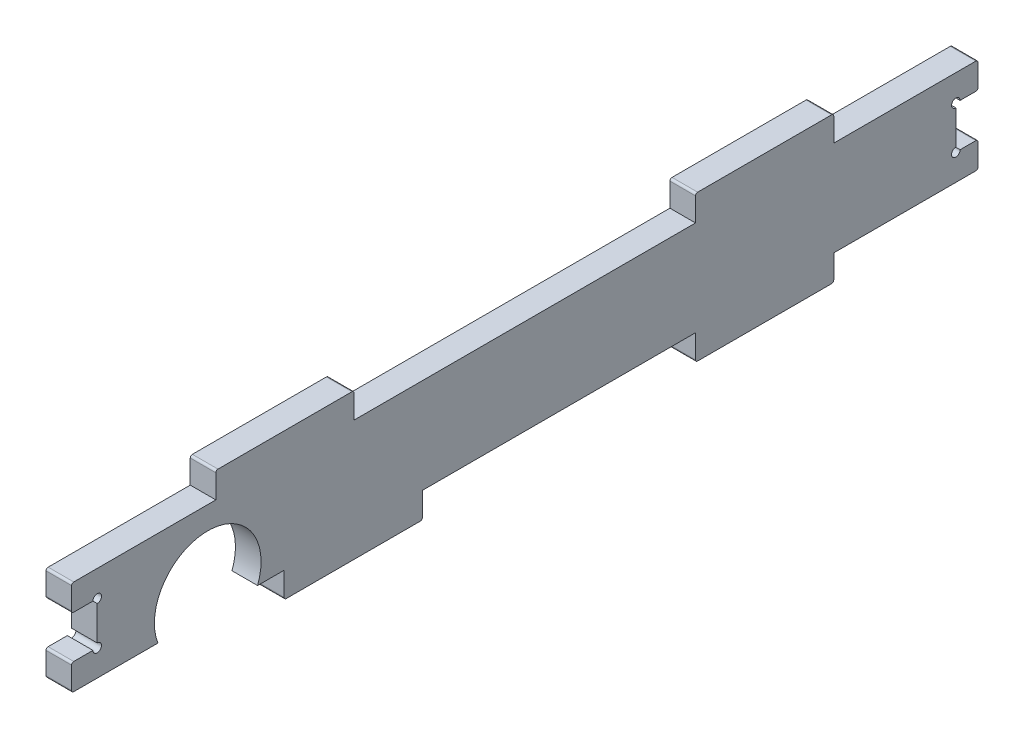
from build123d import *

# Parameters (mm, degrees)
BOSS_EXTRUDE1_DEPTH = 3


with BuildPart() as part:
    # Sketch3 → Boss-Extrude1 (new body)
    with BuildSketch(Plane(origin=(0, 0, 0), x_dir=(0, 0, -1), z_dir=(1, 0, 0))):
        with BuildLine():
            Line((73.486325357, 19.201934502), (89.186325357, 19.201934502))
            ThreePointArc((89.186325357, 19.201934502), (89.363102052, 19.128711197), (89.436325357, 18.951934502))
            Line((89.436325357, 18.951934502), (89.436325357, 16.201934502))
            Line((89.436325357, 16.201934502), (106.086325357, 16.201934502))
            ThreePointArc((106.086325357, 16.201934502), (106.263102052, 16.128711197), (106.336325357, 15.951934502))
            Line((106.336325357, 15.951934502), (106.336325357, 13.383184502))
            ThreePointArc((106.336325357, 13.383184502), (106.263102052, 13.206407807), (106.086325357, 13.133184502))
            Line((106.086325357, 13.133184502), (104.236325357, 13.133184502))
            ThreePointArc((104.236325357, 13.133184502), (103.382771966, 13.486737893), (103.736325357, 12.633184502))
            Line((103.736325357, 12.633184502), (103.736325357, 8.633184502))
            ThreePointArc((103.736325357, 8.633184502), (103.382771966, 7.779631112), (104.236325357, 8.133184502))
            Line((104.236325357, 8.133184502), (106.086325357, 8.133184502))
            ThreePointArc((106.086325357, 8.133184502), (106.263102052, 8.059961197), (106.336325357, 7.883184502))
            Line((106.336325357, 7.883184502), (106.336325357, 5.314434502))
            ThreePointArc((106.336325357, 5.314434502), (106.263102052, 5.137657807), (106.086325357, 5.064434502))
            Line((106.086325357, 5.064434502), (89.436325357, 5.064434502))
            Line((89.436325357, 5.064434502), (89.436325357, 2.314434502))
            ThreePointArc((89.436325357, 2.314434502), (89.363102052, 2.137657807), (89.186325357, 2.064434502))
            Line((89.186325357, 2.064434502), (73.486325357, 2.064434502))
            ThreePointArc((73.486325357, 2.064434502), (73.309548661, 2.137657807), (73.236325357, 2.314434502))
            Line((73.236325357, 2.314434502), (73.236325357, 5.064434502))
            Line((73.236325357, 5.064434502), (41.236325357, 5.064434502))
            Line((41.236325357, 5.064434502), (41.236325357, 2.314434502))
            ThreePointArc((41.236325357, 2.314434502), (41.163102052, 2.137657807), (40.986325357, 2.064434502))
            Line((40.986325357, 2.064434502), (25.286325357, 2.064434502))
            ThreePointArc((25.286325357, 2.064434502), (25.109548661, 2.137657807), (25.036325357, 2.314434502))
            Line((25.036325357, 2.314434502), (25.036325357, 5.064434502))
            Line((25.036325357, 5.064434502), (21.926862575, 5.064434502))
            ThreePointArc((21.926862575, 5.064434502), (16.086325357, 13.539434502), (10.245788138, 5.064434502))
            Line((10.245788138, 5.064434502), (0.386325357, 5.064434502))
            ThreePointArc((0.386325357, 5.064434502), (0.209548661, 5.137657807), (0.136325357, 5.314434502))
            Line((0.136325357, 5.314434502), (0.136325357, 7.883184502))
            ThreePointArc((0.136325357, 7.883184502), (0.209548661, 8.059961197), (0.386325357, 8.133184502))
            Line((0.386325357, 8.133184502), (2.636325357, 8.133184502))
            ThreePointArc((2.636325357, 8.133184502), (3.489878747, 7.779631112), (3.136325357, 8.633184502))
            Line((3.136325357, 8.633184502), (3.136325357, 12.633184502))
            ThreePointArc((3.136325357, 12.633184502), (3.489878747, 13.486737893), (2.636325357, 13.133184502))
            Line((2.636325357, 13.133184502), (0.386325357, 13.133184502))
            ThreePointArc((0.386325357, 13.133184502), (0.209548661, 13.206407807), (0.136325357, 13.383184502))
            Line((0.136325357, 13.383184502), (0.136325357, 15.951934502))
            ThreePointArc((0.136325357, 15.951934502), (0.209548661, 16.128711197), (0.386325357, 16.201934502))
            Line((0.386325357, 16.201934502), (17.036325357, 16.201934502))
            Line((17.036325357, 16.201934502), (17.036325357, 18.951934502))
            ThreePointArc((17.036325357, 18.951934502), (17.109548661, 19.128711197), (17.286325357, 19.201934502))
            Line((17.286325357, 19.201934502), (32.986325357, 19.201934502))
            ThreePointArc((32.986325357, 19.201934502), (33.163102052, 19.128711197), (33.236325357, 18.951934502))
            Line((33.236325357, 18.951934502), (33.236325357, 16.201934502))
            Line((33.236325357, 16.201934502), (73.236325357, 16.201934502))
            Line((73.236325357, 16.201934502), (73.236325357, 18.951934502))
            ThreePointArc((73.236325357, 18.951934502), (73.309548661, 19.128711197), (73.486325357, 19.201934502))
        make_face()
    extrude(amount=BOSS_EXTRUDE1_DEPTH)


solid = part.part
